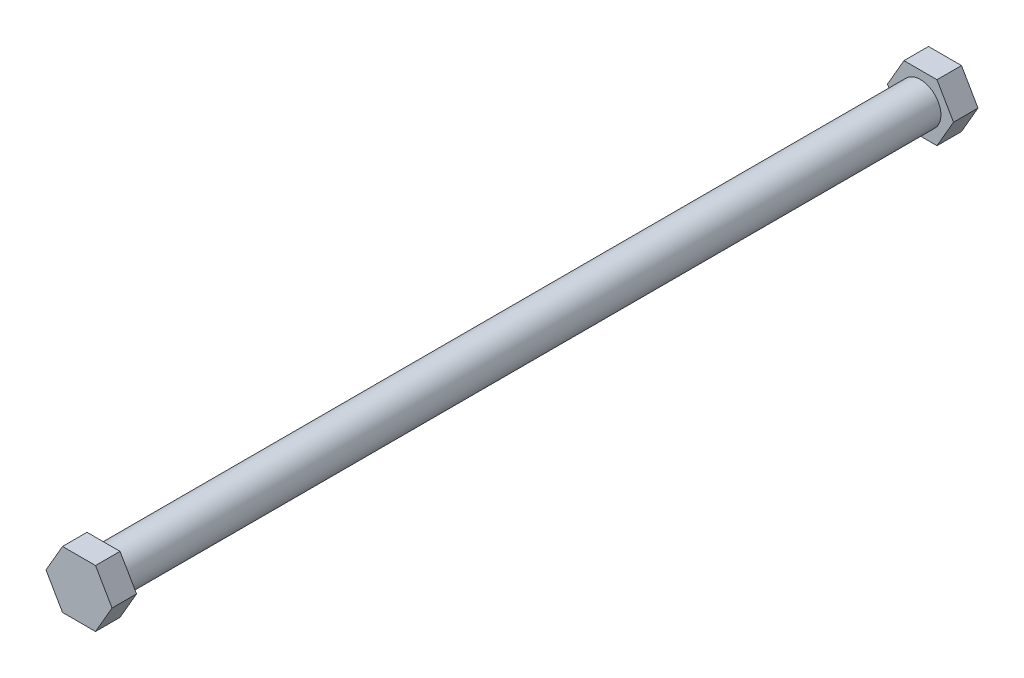
from build123d import *

# Parameters (mm, degrees)
SKETCH_1_R      = 2.5
EXTRUDE_1_DEPTH = 100
EXTRUDE_2_DEPTH = 3
EXTRUDE_START   = 100
EXTRUDE_3_DEPTH = 3


with BuildPart() as part:
    # 草圖1 → 填料-伸長1 (new body)
    with BuildSketch(Plane.XY):
        Circle(SKETCH_1_R)
    extrude(amount=EXTRUDE_1_DEPTH)

    # 草圖3 → 填料-伸長2 (add)
    with BuildSketch(Plane.XY):
        Polygon((2.020725942, 3.5), (-2.020725942, 3.5), (-4.041451884, 0), (-2.020725942, -3.5), (2.020725942, -3.5), (4.041451884, 0), align=None)
    extrude(amount=-EXTRUDE_2_DEPTH)

    # 草圖4 → 填料-伸長3 (add)
    with BuildSketch(Plane.XY.offset(EXTRUDE_START)):
        Polygon((-4.041451884, 0), (-2.020725942, -3.5), (2.020725942, -3.5), (4.041451884, 0), (2.020725942, 3.5), (-2.020725942, 3.5), align=None)
    extrude(amount=EXTRUDE_3_DEPTH)


solid = part.part
